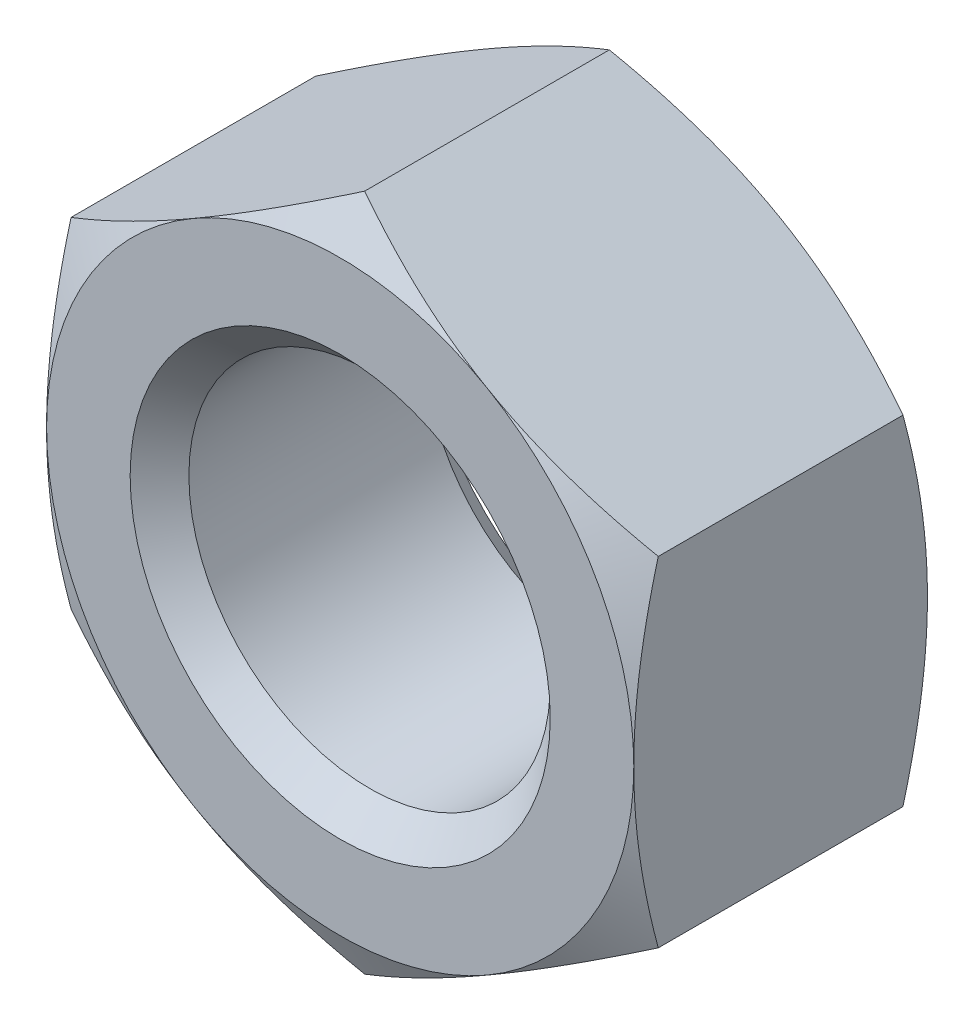
from build123d import *

# Parameters (mm, degrees)
SKETCH1_R           = 4
BOSS_EXTRUDE1_DEPTH = 6.5


with BuildPart() as part:
    # Sketch1 → Boss-Extrude1 (new body)
    with BuildSketch(Plane.XY):
        Polygon((0, -7.505553499), (6.5, -3.75277675), (6.5, 3.75277675), (0, 7.505553499), (-6.5, 3.75277675), (-6.5, -3.75277675), align=None)
        with Locations(Location((0, 0, 0), (0, 0, 180))):
            Circle(SKETCH1_R, mode=Mode.SUBTRACT)
    extrude(amount=BOSS_EXTRUDE1_DEPTH)

    # Sketch2 → Cut-Revolve1 (revolve, cut)
    with BuildSketch(Plane(origin=(0, 0, 0), x_dir=(0, 0, -1), z_dir=(1, 0, 0)), mode=Mode.PRIVATE) as cut_revolve1_sk:
        Polygon((-6.5, 7.505553499), (-6.5, 6.5), (-5.958333333, 7.505553499), align=None)
        Polygon((-0.541666667, 7.505553499), (0, 7.505553499), (0, 6.5), align=None)
        Polygon((-6.5, 4), (-5.85, 4), (-6.5, 4.65), align=None)
        Polygon((0, 4), (-0.65, 4), (0, 4.65), align=None)
    revolve(cut_revolve1_sk.sketch.rotate(Axis((0, 0, 0), (0, 0, 1)), 90), axis=Axis((0, 0, 0), (0, 0, 1)), mode=Mode.SUBTRACT)


solid = part.part
